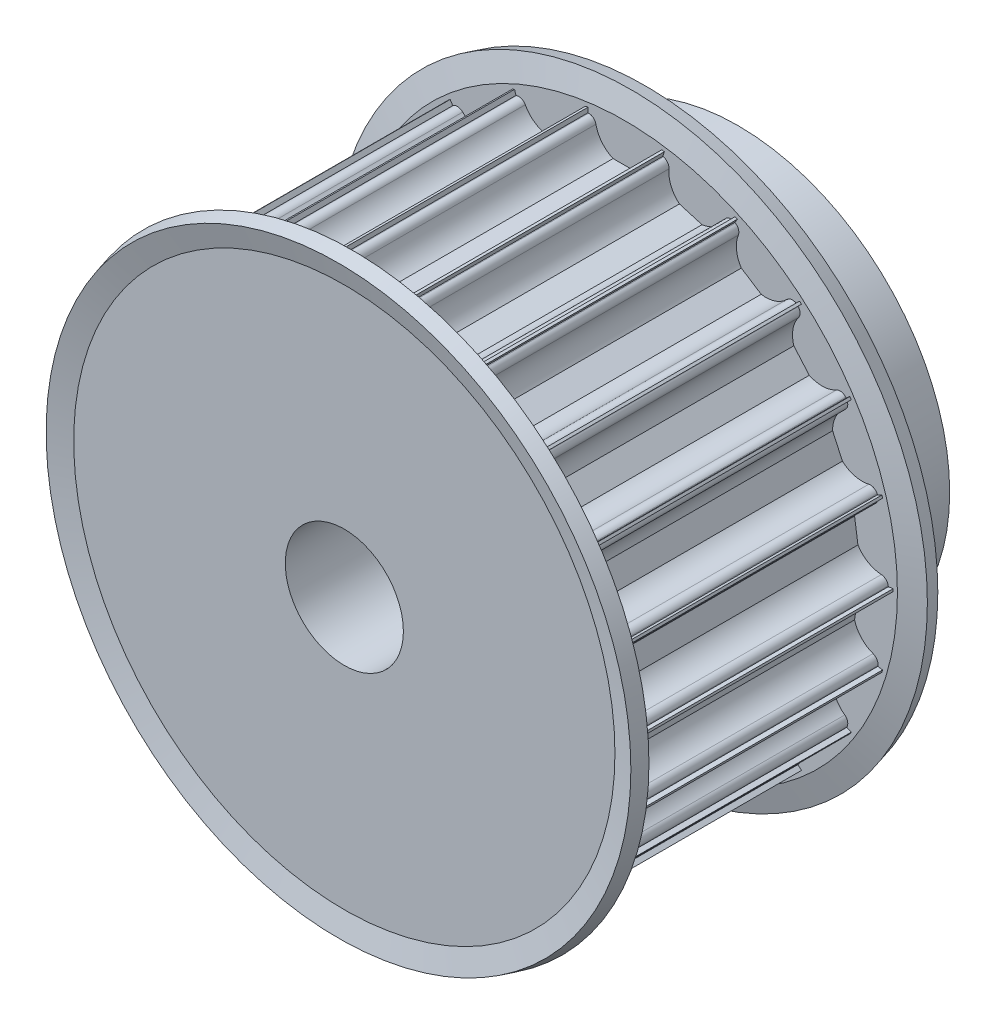
from build123d import *

# Parameters (mm, degrees)
CUT_EXTRUDE1_DEPTH = 56.543901555
CIRPATTERN1_COUNT  = 22


with BuildPart() as part:
    # Sketch1 → Revolve1 (revolve)
    with BuildSketch(Plane(origin=(0, 0, 0), x_dir=(0, 0, -1), z_dir=(1, 0, 0)), mode=Mode.PRIVATE) as revolve1_sk:
        Polygon((0, 6), (0, 27.25), (30, 27.25), (30, 21.5), (40, 21.5), (40, 6), align=None)
    revolve(revolve1_sk.sketch.rotate(Axis((0, 0, 55), (0, 0, -1)), 90), axis=Axis((0, 0, 55), (0, 0, -1)))

    # Sketch2 → Cut-Extrude1 (cut, through all)
    with BuildSketch(Plane.XY):
        with BuildLine():
            Line((3.674234614, 26.5), (3.75, 26.5))
            Line((3.75, 26.5), (3.75, 28.5))
            Line((3.75, 28.5), (-3.75, 28.5))
            Line((-3.75, 28.5), (-3.75, 26.5))
            Line((-3.75, 26.5), (-3.674234614, 26.5))
            ThreePointArc((-3.674234614, 26.5), (-3.199892965, 26.330947502), (-2.939387691, 25.9))
            ThreePointArc((-2.939387691, 25.9), (-2.331759211, 24.612435701), (-1.198957881, 23.75))
            Line((-1.198957881, 23.75), (1.198957881, 23.75))
            ThreePointArc((1.198957881, 23.75), (2.331759211, 24.612435701), (2.939387691, 25.9))
            ThreePointArc((2.939387691, 25.9), (3.199892965, 26.330947502), (3.674234614, 26.5))
        make_face()
    cut_extrude1 = extrude(amount=-CUT_EXTRUDE1_DEPTH, mode=Mode.SUBTRACT)

    # CirPattern1: Cut-Extrude1 ×22 about axis
    cirpattern1_axis = Axis((0, 0, 0), (0, 0, 1))
    for i in range(1, CIRPATTERN1_COUNT):
        add(cut_extrude1.rotate(cirpattern1_axis, i * 360 / CIRPATTERN1_COUNT), mode=Mode.SUBTRACT)

    # Sketch3 → Revolve3 (revolve)
    with BuildSketch(Plane(origin=(0, 0, 0), x_dir=(0, 0, -1), z_dir=(1, 0, 0)), mode=Mode.PRIVATE) as revolve3_sk:
        Polygon((0, 27.493260406), (0, 22.690739153), (1.5, 22.690739153), (1.5, 27.690739153), (0.856921938, 30.090739153), (-0.591966801, 29.702510585), align=None)
        Polygon((30.591966801, 29.702510585), (29.143078062, 30.090739153), (28.5, 27.690739153), (28.5, 22.690739153), (30, 22.690739153), (30, 27.493260406), align=None)
    revolve(revolve3_sk.sketch.rotate(Axis((0, 0, 55), (0, 0, -1)), 90), axis=Axis((0, 0, 55), (0, 0, -1)))


solid = part.part
